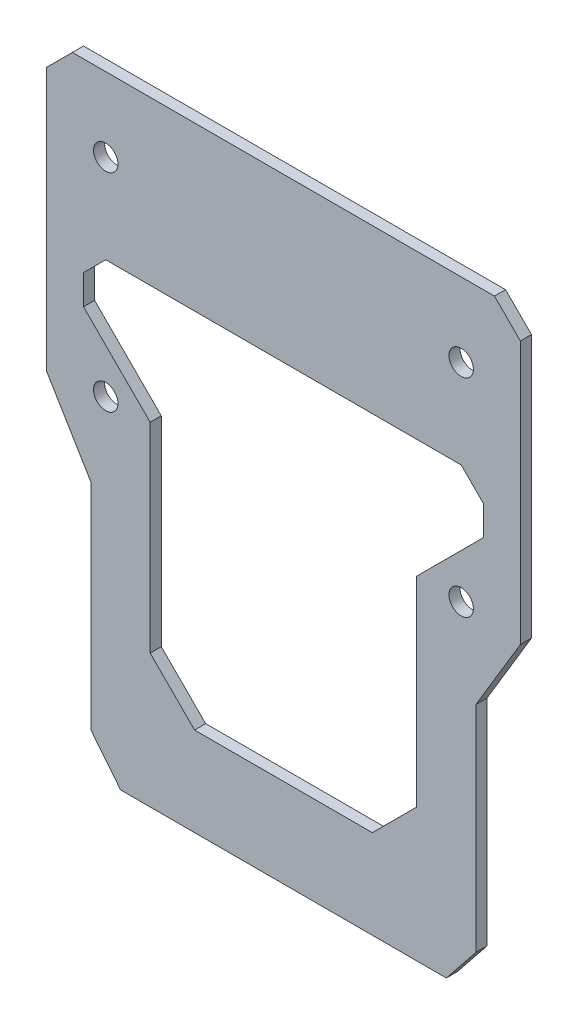
from build123d import *

# Parameters (mm, degrees)
SKETCH_1_R            = 1.65
EXTRUDE_267_DEPTH     = 1.5
SKETCH_3_W            = 200
SKETCH_3_H            = 2
CUT_EXTRUDE_0P5_DEPTH = 1.5


with BuildPart() as part:
    # 草图1 → Extrude 267 (new body)
    with BuildSketch(Plane.XY):
        Polygon((-22, 0), (22, 0), (26, 5), (26, 34), (32, 44), (32, 79.5), (28, 83.5), (-28, 83.5), (-32, 79.5), (-32, 44), (-26, 34), (-26, 5), align=None)
        with Locations((-24, 45)):
            Circle(SKETCH_1_R, mode=Mode.SUBTRACT)
        with Locations((24, 45)):
            Circle(SKETCH_1_R, mode=Mode.SUBTRACT)
        with Locations((-24, 73)):
            Circle(SKETCH_1_R, mode=Mode.SUBTRACT)
        with Locations((24, 73)):
            Circle(SKETCH_1_R, mode=Mode.SUBTRACT)
        Polygon((-24, 61), (24, 61), (27, 58), (27, 54), (18, 45), (18, 18), (12, 12), (-12, 12), (-18, 18), (-18, 45), (-27, 54), (-27, 58), align=None, mode=Mode.SUBTRACT)
    extrude(amount=EXTRUDE_267_DEPTH)

    # 草图3 → 底板加厚上沿退让0p5 (cut)
    with BuildSketch(Plane.XY):
        with Locations((0, 84)):
            Rectangle(SKETCH_3_W, SKETCH_3_H)
    extrude(amount=CUT_EXTRUDE_0P5_DEPTH, mode=Mode.SUBTRACT)


solid = part.part
